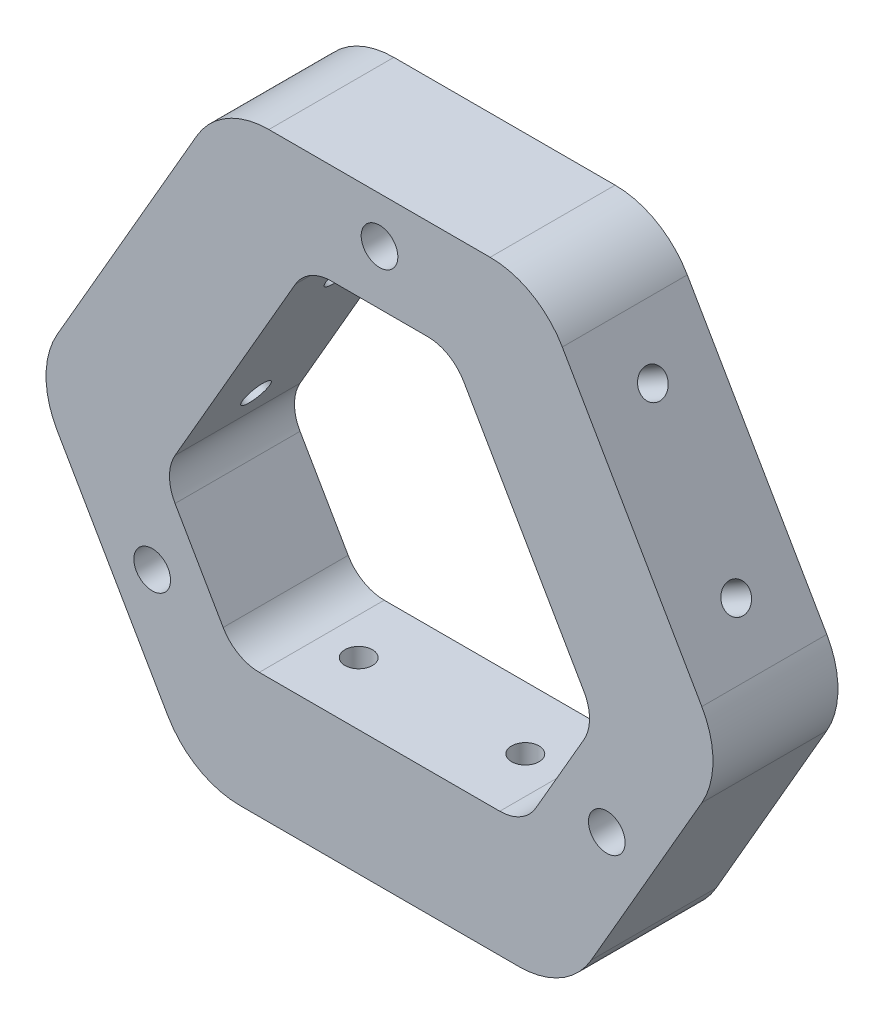
from build123d import *

# Parameters (mm, degrees)
EXTRUDE_1_DEPTH     = 15
FILLET_1_R          = 10
FILLET_2_R          = 5
SKETCH_2_R          = 1.65
CUT_EXTRUDE_1_DEPTH = 20
SKETCH_4_R          = 1.65
CUT_EXTRUDE_2_DEPTH = 20
SKETCH_5_R          = 1.65
CUT_EXTRUDE_3_DEPTH = 20
CUT_EXTRUDE_4_DEPTH = 15
EXTRUDE_2_DEPTH     = 15
CUT_EXTRUDE_5_DEPTH = 61.827625303
FILLET_3_R          = 10
FILLET_4_R          = 5
SKETCH_9_R          = 2.2
CUT_EXTRUDE_6_DEPTH = 57.531209197


with BuildPart() as part:
    # 草图1 → 凸台-拉伸1 (new body)
    with BuildSketch(Plane.XY):
        Polygon((0, 70), (-60.621778265, -35), (60.621778265, -35), align=None)
        Polygon((0, 40), (-34.641016151, -20), (34.641016151, -20), align=None, mode=Mode.SUBTRACT)
    extrude(amount=EXTRUDE_1_DEPTH)

    # 圆角1
    fillet_1_edges = [part.edges().sort_by_distance(p)[0] for p in [
        (60.621778265, -35, 7.5),
        (-60.621778265, -35, 7.5),
        (0, 70, 7.5),
    ]]
    fillet(fillet_1_edges, radius=FILLET_1_R)

    # 圆角2
    fillet_2_edges = [part.edges().sort_by_distance(p)[0] for p in [
        (34.641016151, -20, 7.5),
        (0, 40, 7.5),
        (-34.641016151, -20, 7.5),
    ]]
    fillet(fillet_2_edges, radius=FILLET_2_R)

    # 草图2 → 切除-拉伸1 (cut)
    with BuildSketch(Plane.XZ.offset(35)):
        with Locations((-10, 7.5)):
            Circle(SKETCH_2_R)
        with Locations(Location((10, 7.5, 0), (0, 0, 180))):
            Circle(SKETCH_2_R)
    extrude(amount=-CUT_EXTRUDE_1_DEPTH, mode=Mode.SUBTRACT)

    # 草图4 → 切除-拉伸2 (cut)
    with BuildSketch(Plane(origin=(30.310889132, 17.5, 0), x_dir=(0, 0, -1), z_dir=(0.8660254037844386, 0.5000000000000003, 0))):
        with Locations(Location((-7.5, 10, 0), (0, 0, 90))):
            Circle(SKETCH_4_R)
        with Locations(Location((-7.5, -10, 0), (0, 0, 270))):
            Circle(SKETCH_4_R)
    extrude(amount=-CUT_EXTRUDE_2_DEPTH, mode=Mode.SUBTRACT)

    # 草图5 → 切除-拉伸3 (cut)
    with BuildSketch(Plane(origin=(-30.310889132, 17.5, 0), x_dir=(0, 0, 1), z_dir=(-0.8660254037844386, 0.5000000000000003, 0))):
        with Locations(Location((7.5, 10, 0), (0, 0, 270))):
            Circle(SKETCH_5_R)
        with Locations(Location((7.5, -10, 0), (0, 0, 90))):
            Circle(SKETCH_5_R)
    extrude(amount=-CUT_EXTRUDE_3_DEPTH, mode=Mode.SUBTRACT)

    # 草图6 → 切除-拉伸4 (cut)
    with BuildSketch(Plane.XY.offset(15)):
        with BuildLine():
            Line((-8.660254038, 55), (-17.320508076, 40))
            Line((-17.320508076, 40), (17.320508076, 40))
            Line((17.320508076, 40), (8.660254038, 55))
            ThreePointArc((8.660254038, 55), (0, 60), (-8.660254038, 55))
        make_face()
        with BuildLine():
            Line((-25.980762114, -35), (-43.301270189, -5))
            Line((-43.301270189, -5), (-51.961524227, -20))
            ThreePointArc((-51.961524227, -20), (-51.961524227, -30), (-43.301270189, -35))
            Line((-43.301270189, -35), (-25.980762114, -35))
        make_face()
        with BuildLine():
            Line((51.961524227, -20), (43.301270189, -5))
            Line((43.301270189, -5), (25.980762114, -35))
            Line((25.980762114, -35), (43.301270189, -35))
            ThreePointArc((43.301270189, -35), (51.961524227, -30), (51.961524227, -20))
        make_face()
    extrude(amount=-CUT_EXTRUDE_4_DEPTH, mode=Mode.SUBTRACT)

    # 草图7 → 凸台-拉伸2 (add)
    with BuildSketch(Plane.XY.offset(15)):
        with BuildLine():
            Line((-4.330127019, 32.5), (-8.660254038, 25))
            Line((-8.660254038, 25), (8.660254038, 25))
            Line((8.660254038, 25), (4.330127019, 32.5))
            ThreePointArc((4.330127019, 32.5), (0, 35), (-4.330127019, 32.5))
        make_face()
        with BuildLine():
            Line((-17.320508076, -20), (-25.980762114, -5))
            Line((-25.980762114, -5), (-30.310889132, -12.5))
            ThreePointArc((-30.310889132, -12.5), (-30.310889132, -17.5), (-25.980762114, -20))
            Line((-25.980762114, -20), (-17.320508076, -20))
        make_face()
        with BuildLine():
            Line((30.310889132, -12.5), (25.980762114, -5))
            Line((25.980762114, -5), (17.320508076, -20))
            Line((17.320508076, -20), (25.980762114, -20))
            ThreePointArc((25.980762114, -20), (30.310889132, -17.5), (30.310889132, -12.5))
        make_face()
    extrude(amount=-EXTRUDE_2_DEPTH)

    # 草图8 → 切除-拉伸5 (cut, through all)
    with BuildSketch(Plane.XY.offset(15)):
        Polygon((-17.320508076, 40), (-19.052558883, 37), (19.052558883, 37), (17.320508076, 40), align=None)
        Polygon((-22.516660498, -35), (-41.569219382, -2), (-43.301270189, -5), (-25.980762114, -35), align=None)
        Polygon((43.301270189, -5), (41.569219382, -2), (22.516660498, -35), (25.980762114, -35), align=None)
    extrude(amount=-CUT_EXTRUDE_5_DEPTH, mode=Mode.SUBTRACT)

    # 圆角3
    fillet_3_edges = [part.edges().sort_by_distance(p)[0] for p in [
        (-19.052558883, 37, 7.5),
        (19.052558883, 37, 7.5),
        (-22.516660498, -35, 7.5),
        (-41.569219382, -2, 7.5),
        (41.569219382, -2, 7.5),
        (22.516660498, -35, 7.5),
    ]]
    fillet(fillet_3_edges, radius=FILLET_3_R)

    # 圆角4
    fillet_4_edges = [part.edges().sort_by_distance(p)[0] for p in [
        (-8.660254038, 25, 7.5),
        (8.660254038, 25, 7.5),
        (-17.320508076, -20, 7.5),
        (-25.980762114, -5, 7.5),
        (25.980762114, -5, 7.5),
        (17.320508076, -20, 7.5),
    ]]
    fillet(fillet_4_edges, radius=FILLET_4_R)

    # 草图9 → 切除-拉伸6 (cut, through all)
    with BuildSketch(Plane.XY.offset(15)):
        with Locations((0, 31.5)):
            Circle(SKETCH_9_R)
        with Locations((27.279800219, -15.75)):
            Circle(SKETCH_9_R)
        with Locations((-27.279800219, -15.75)):
            Circle(SKETCH_9_R)
    extrude(amount=-CUT_EXTRUDE_6_DEPTH, mode=Mode.SUBTRACT)


solid = part.part
